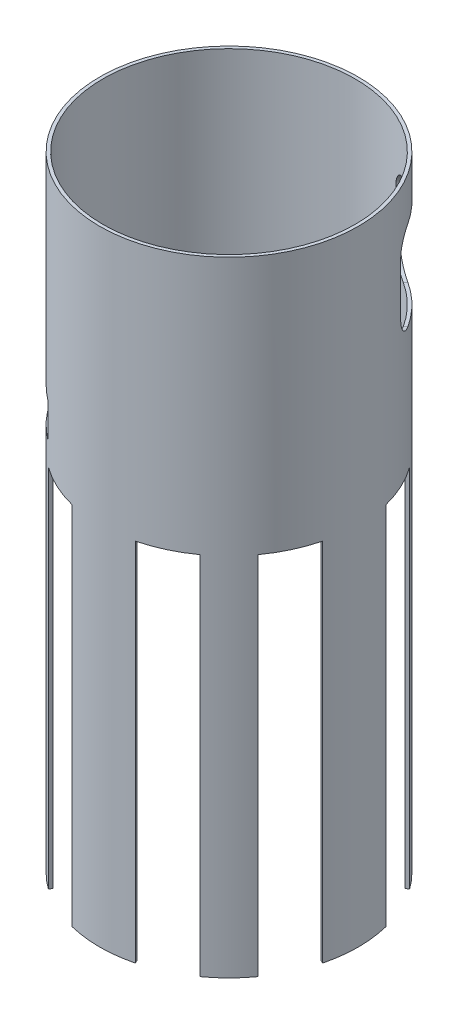
from build123d import *

# Parameters (mm, degrees)
SKETCH1_R           = 40
SKETCH1_R_2         = 39
BOSS_EXTRUDE1_DEPTH = 193
CUT_EXTRUDE3_START  = -80
CUT_EXTRUDE3_DEPTH  = 150
CUT_EXTRUDE4_DEPTH  = 35
SKETCH22_R          = 1.7
CUT_EXTRUDE5_DEPTH  = 5.3
CIRPATTERN1_COUNT   = 4
SKETCH24_W          = 31.232190918
SKETCH24_H          = 10.655653456
CUT_EXTRUDE6_DEPTH  = 13.3


with BuildPart() as part:
    # Sketch1 → Boss-Extrude1 (new body)
    with BuildSketch(Plane(origin=(0, 63, 0), x_dir=(1, 0, 0), z_dir=(0, 1, 0))):
        with Locations(Location((0, 0, 0), (0, 0, 270))):
            Circle(SKETCH1_R)
        with Locations(Location((0, 0, 0), (0, 0, 270))):
            Circle(SKETCH1_R_2, mode=Mode.SUBTRACT)
    extrude(amount=BOSS_EXTRUDE1_DEPTH)

    # Sketch11 → Cut-Extrude3 (cut)
    with BuildSketch(Plane(origin=(0, 256, 0), x_dir=(1, 0, 0), z_dir=(0, 1, 0)).offset(CUT_EXTRUDE3_START)):
        Polygon((16.455199497, 17.541777329), (2.860582691, 23.881051254), (12.76219936, 45.115136729), (26.356816166, 38.775862804), align=None)
        Polygon((-17.541777329, 16.455199497), (-23.881051254, 2.860582691), (-45.115136729, 12.76219936), (-38.775862804, 26.356816166), align=None)
        Polygon((17.541777329, -16.455199497), (23.881051254, -2.860582691), (45.115136729, -12.76219936), (38.775862804, -26.356816166), align=None)
        Polygon((-16.455199497, -17.541777329), (-2.860582691, -23.881051254), (-12.76219936, -45.115136729), (-26.356816166, -38.775862804), align=None)
        Polygon((-43.620574428, -12.065273515), (-21.566495936, -1.781287822), (-15.22722201, -15.375904627), (-37.281300502, -25.659890321), align=None)
        Polygon((-12.065273515, 43.620574428), (-1.781287822, 21.566495936), (-15.375904627, 15.22722201), (-25.659890321, 37.281300502), align=None)
        Polygon((43.620574428, 12.065273515), (21.566495936, 1.781287822), (15.22722201, 15.375904627), (37.281300502, 25.659890321), align=None)
        Polygon((12.065273515, -43.620574428), (1.781287822, -21.566495936), (15.375904627, -15.22722201), (25.659890321, -37.281300502), align=None)
    extrude(amount=-CUT_EXTRUDE3_DEPTH, mode=Mode.SUBTRACT)

    # Sketch20 → Cut-Extrude4 (cut)
    with BuildSketch(Plane(origin=(30.542754268, 0, -30.542754268), x_dir=(-0.7043828553421385, 0.08769028567936554, -0.7043828553404231), z_dir=(0.7071067811856864, -4.163336342344337e-15, -0.7071067811874089))):
        with BuildLine():
            Line((7.051429642, 237.476570021), (5.590509483, 220.880747887))
            ThreePointArc((5.590509483, 220.880747887), (6.847288676, 216.88728279), (10.559772016, 214.952153629))
            Line((10.559772016, 214.952153629), (27.155594149, 213.491233469))
            ThreePointArc((27.155594149, 213.491233469), (31.149059247, 214.748012662), (33.084188408, 218.460496002))
            Line((33.084188408, 218.460496002), (34.545108567, 235.056318136))
            ThreePointArc((34.545108567, 235.056318136), (33.288329374, 239.049783233), (29.575846034, 240.984912394))
            Line((29.575846034, 240.984912394), (12.980023901, 242.445832553))
            ThreePointArc((12.980023901, 242.445832553), (8.986558804, 241.189053361), (7.051429642, 237.476570021))
        make_face()
    extrude(amount=-CUT_EXTRUDE4_DEPTH, mode=Mode.SUBTRACT)

    # Sketch22 → Cut-Extrude5 (cut)
    with BuildSketch(Plane(origin=(24.169183991, 0, -24.169183991), x_dir=(0.7071067811865483, 0, 0.7071067811865468), z_dir=(-0.7071067811865468, 0, 0.7071067811865483))):
        with Locations((0, 68)):
            Circle(SKETCH22_R)
    cut_extrude5 = extrude(amount=-CUT_EXTRUDE5_DEPTH, mode=Mode.SUBTRACT)

    # CirPattern1: Cut-Extrude5 ×4 about axis
    cirpattern1_axis = Axis((0, 0, 0), (0, 1, 0))
    for i in range(1, CIRPATTERN1_COUNT):
        add(cut_extrude5.rotate(cirpattern1_axis, i * 360 / CIRPATTERN1_COUNT), mode=Mode.SUBTRACT)

    # Sketch24 → Cut-Extrude6 (cut)
    with BuildSketch(Plane(origin=(-28.056295298, 0, 20.384091712), x_dir=(-0.5877852522931263, 0, -0.8090169943744729), z_dir=(0.8090169943744729, 0, -0.5877852522931263))):
        with Locations((3.911568973, 188.130853463)):
            Rectangle(SKETCH24_W, SKETCH24_H)
    extrude(amount=-CUT_EXTRUDE6_DEPTH, mode=Mode.SUBTRACT)


solid = part.part
